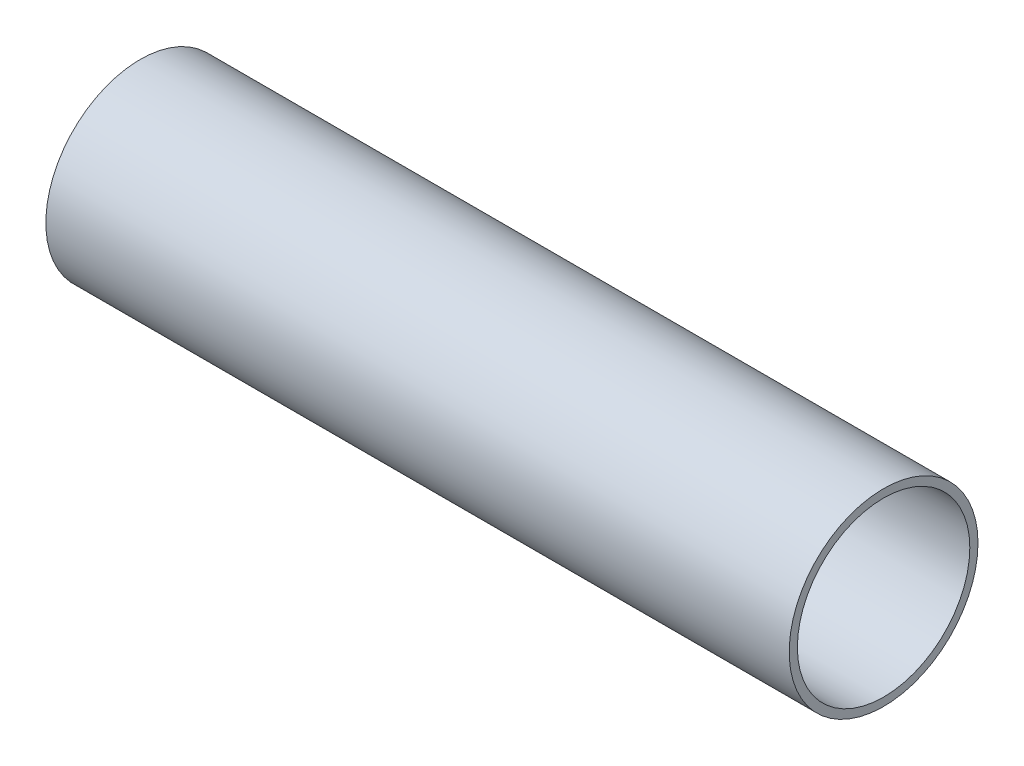
from build123d import *

# Parameters (mm, degrees)
CROQUIS1_R              = 19.05
SALIENTE_EXTRUIR1_DEPTH = 75
CROQUIS2_R              = 17.4
CORTAR_EXTRUIR1_DEPTH   = 197


with BuildPart() as part:
    # Croquis1 → Saliente-Extruir1 (new, symmetric)
    with BuildSketch(Plane(origin=(0, 0, 0), x_dir=(0, 0, -1), z_dir=(1, 0, 0))):
        Circle(CROQUIS1_R)
    extrude(amount=SALIENTE_EXTRUIR1_DEPTH, both=True)

    # Croquis2 → Cortar-Extruir1 (cut)
    with BuildSketch(Plane.ZY.offset(75)):
        Circle(CROQUIS2_R)
    extrude(amount=-CORTAR_EXTRUIR1_DEPTH, mode=Mode.SUBTRACT)


solid = part.part
